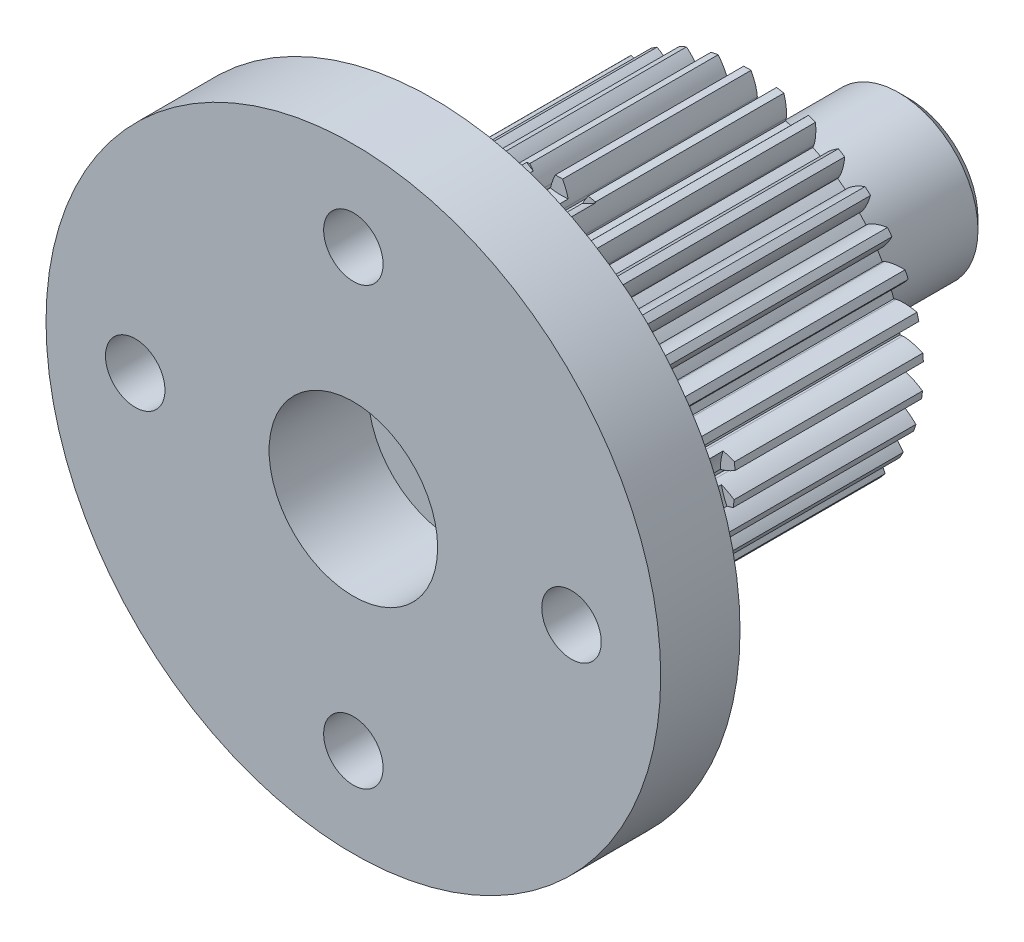
from build123d import *

# Parameters (mm, degrees)
SKETCH1_R           = 8.75
BOSS_EXTRUDE1_DEPTH = 8
CUT_EXTRUDE1_DEPTH  = 15.735162028
CIRPATTERN2_COUNT   = 33
SKETCH3_W           = 15.5
SKETCH3_H           = 4
CHAMFER1_SIZE       = 0.5
CHAMFER2_SIZE       = 0.5
SKETCH4_R           = 2.5
CUT_EXTRUDE2_DEPTH  = 36.559808861
SKETCH5_R           = 4.25
CUT_EXTRUDE3_DEPTH  = 5
SKETCH6_R           = 1.5
CUT_EXTRUDE4_DEPTH  = 33.503846022
CIRPATTERN3_COUNT   = 4
SKETCH8_R           = 3
CUT_EXTRUDE5_DEPTH  = 6.5


with BuildPart() as part:
    # Sketch1 → Boss-Extrude1 (new, symmetric)
    with BuildSketch(Plane.XY):
        Circle(SKETCH1_R)
    extrude(amount=BOSS_EXTRUDE1_DEPTH, both=True)

    # Sketch2 → Cut-Extrude1 (cut, symmetric)
    with BuildSketch(Plane.XY):
        with BuildLine():
            add(Edge.make_bspline(
                [(7.75246412, 0), (7.75511433, 3.8128e-05), (7.762545642, 0.000263143), (7.785480455, 0.001719736), (7.830623355, 0.006735296), (7.88613256, 0.01599645), (7.949655279, 0.029566982), (8.010654672, 0.044956876), (8.0625976, 0.059532769), (8.114195286, 0.075387755), (8.165384381, 0.092364981), (8.22711953, 0.114322051), (8.300754213, 0.142582924), (8.38619151, 0.178412613), (8.48230087, 0.222336986), (8.579326466, 0.270588803), (8.655734847, 0.311207853), (8.70847079, 0.340802772), (8.737244591, 0.3573388), (8.742574057, 0.360414851)],
                knots=[0, 0, 0, 0, 0, 0.005376749, 0.015083688, 0.04661014, 0.092110525, 0.119476176, 0.146842496, 0.174208854, 0.201574956, 0.228941013, 0.256307345, 0.307035032, 0.361767352, 0.416499661, 0.471231937, 0.525964282, 0.538437162, 0.538437162, 0.538437162, 0.538437162, 0.538437162], degree=4))
            Line((7.75246412, 0), (7.625, 0))
            ThreePointArc((7.625, 0), (7.620924816, -0.24925881), (7.608703619, -0.498251186))
            Line((7.608703619, -0.498251186), (7.735895318, -0.506580255))
            add(Edge.make_bspline(
                [(7.735895318, -0.506580255), (7.738537373, -0.506791478), (7.745938099, -0.507501606), (7.768728715, -0.510453749), (7.813447395, -0.518408426), (7.8682328, -0.531277003), (7.930732997, -0.548969387), (7.990596377, -0.568312359), (8.041475837, -0.586251281), (8.091927212, -0.605444002), (8.141897538, -0.625729865), (8.202065972, -0.651674055), (8.273696591, -0.684686143), (8.356610018, -0.726022106), (8.449643759, -0.776132813), (8.543309001, -0.830621586), (8.616899851, -0.876146685), (8.667589223, -0.909124352), (8.695220991, -0.927505246), (8.700338063, -0.930922974)],
                knots=[0, 0, 0, 0, 0, 0.005376749, 0.015083688, 0.04661014, 0.092110525, 0.119476176, 0.146842496, 0.174208854, 0.201574956, 0.228941013, 0.256307345, 0.307035032, 0.361767352, 0.416499661, 0.471231937, 0.525964282, 0.538437162, 0.538437162, 0.538437162, 0.538437162, 0.538437162], degree=4))
            ThreePointArc((8.700338063, -0.930922974), (8.737575695, -0.466123345), (8.75, 0))
            ThreePointArc((8.75, 0), (8.748143317, 0.180245672), (8.742574057, 0.360414851))
        make_face()
    cut_extrude1 = extrude(amount=CUT_EXTRUDE1_DEPTH, both=True, mode=Mode.SUBTRACT)

    # CirPattern2: Cut-Extrude1 ×33 about axis
    cirpattern2_axis = Axis((0, 0, -8), (0, 0, 1))
    for i in range(1, CIRPATTERN2_COUNT):
        add(cut_extrude1.rotate(cirpattern2_axis, i * 360 / CIRPATTERN2_COUNT), mode=Mode.SUBTRACT)

    # Sketch3 → Revolve1 (revolve)
    with BuildSketch(Plane(origin=(0, 0, 0), x_dir=(1, 0, 0), z_dir=(0, 1, 0)), mode=Mode.PRIVATE) as revolve1_sk:
        Polygon((0, 8), (0, 16), (-4, 16), (-4, 9.5), (-4.5, 9.5), (-4.5, 8), align=None)
        with Locations((-7.75, -10)):
            Rectangle(SKETCH3_W, SKETCH3_H)
    revolve(revolve1_sk.sketch.rotate(Axis((0, 0, -8), (0, 0, -1)), 180), axis=Axis((0, 0, -8), (0, 0, -1)))

    # Chamfer1
    chamfer1_edges = [part.edges().sort_by_distance(p)[0] for p in [
        (-4.5, 0, -8),
    ]]
    chamfer(chamfer1_edges, length=CHAMFER1_SIZE)

    # Chamfer2
    chamfer2_edges = [part.edges().sort_by_distance(p)[0] for p in [
        (-4, 0, -16),
    ]]
    chamfer(chamfer2_edges, length=CHAMFER2_SIZE)

    # Sketch4 → Cut-Extrude2 (cut, through all)
    with BuildSketch(Plane.XY.offset(12)):
        Circle(SKETCH4_R)
    extrude(amount=-CUT_EXTRUDE2_DEPTH, mode=Mode.SUBTRACT)

    # Sketch5 → Cut-Extrude3 (cut)
    with BuildSketch(Plane.XY.offset(12)):
        Circle(SKETCH5_R)
    extrude(amount=-CUT_EXTRUDE3_DEPTH, mode=Mode.SUBTRACT)

    # Sketch6 → Cut-Extrude4 (cut, through all)
    with BuildSketch(Plane(origin=(0, 0, 8), x_dir=(-1, 0, 0), z_dir=(0, 0, -1))):
        with Locations((0, 11)):
            Circle(SKETCH6_R)
        with Locations((11, 0)):
            Circle(SKETCH6_R)
        with Locations((0, -11)):
            Circle(SKETCH6_R)
        with Locations((-11, 0)):
            Circle(SKETCH6_R)
    extrude(amount=-CUT_EXTRUDE4_DEPTH, mode=Mode.SUBTRACT)

    # Sketch7 → Cut-Revolve1 (revolve, cut)
    with BuildSketch(Plane(origin=(0, 0, 0), x_dir=(1, 0, 0), z_dir=(0, 1, 0)), mode=Mode.PRIVATE) as cut_revolve1_sk:
        Polygon((14, -8), (11, -8), (11, -9.5), (12.5, -9.5), align=None)
    cut_revolve1 = revolve(cut_revolve1_sk.sketch.rotate(Axis((11, 0, 8), (0, 0, 1)), 180), axis=Axis((11, 0, 8), (0, 0, 1)), mode=Mode.SUBTRACT)

    # CirPattern3: Cut-Revolve1 ×4 about axis
    cirpattern3_axis = Axis((0, 0, 0), (0, 0, 1))
    for i in range(1, CIRPATTERN3_COUNT):
        add(cut_revolve1.rotate(cirpattern3_axis, i * 360 / CIRPATTERN3_COUNT), mode=Mode.SUBTRACT)

    # Sketch8 → Cut-Extrude5 (cut)
    with BuildSketch(Plane(origin=(0, 0, 8), x_dir=(-1, 0, 0), z_dir=(0, 0, -1))):
        with Locations((0, 11)):
            Circle(SKETCH8_R)
        with Locations((11, 0)):
            Circle(SKETCH8_R)
        with Locations((0, -11)):
            Circle(SKETCH8_R)
        with Locations((-11, 0)):
            Circle(SKETCH8_R)
    extrude(amount=CUT_EXTRUDE5_DEPTH, mode=Mode.SUBTRACT)


solid = part.part
